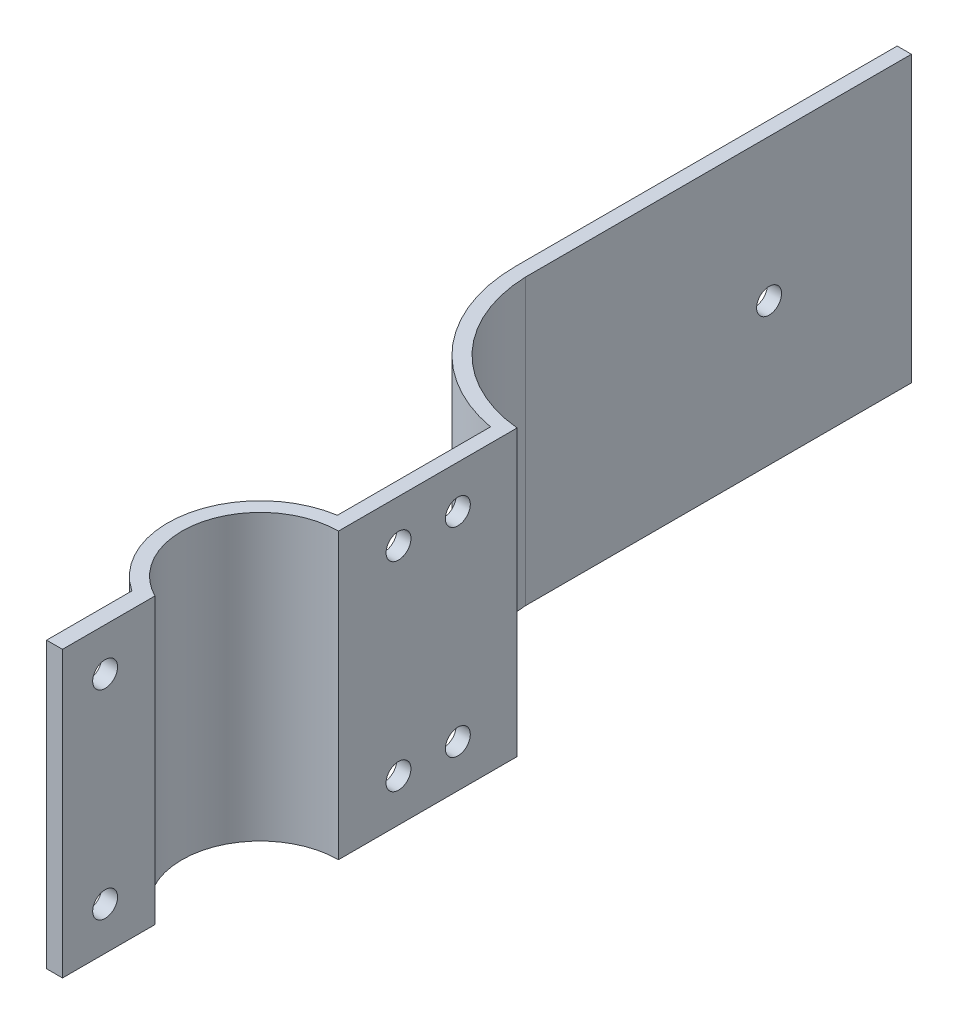
from build123d import *

# Parameters (mm, degrees)
BOSS_EXTRUDE1_DEPTH     = 40
CUT_EXTRUDE1_DEPTH      = 118.727312348
CUT_EXTRUDE1_DEPTH_BACK = 118.727312348
SKETCH3_R               = 1.75


with BuildPart() as part:
    # Sketch1 → Boss-Extrude1 (new body)
    with BuildSketch(Plane(origin=(0, 0, 0), x_dir=(1, 0, 0), z_dir=(0, 1, 0))):
        with BuildLine():
            Line((0, 11), (0, 36.098802305))
            ThreePointArc((0, 36.098802305), (-12.451450114, 42.224601119), (-17.776180484, 55.03909555))
            Line((-17.776180484, 55.03909555), (-17.776180484, 109.287361941))
            Line((-17.776180484, 109.287361941), (-19.776180484, 109.287361941))
            Line((-19.776180484, 109.287361941), (-19.776180484, 55.700978031))
            ThreePointArc((-19.776180484, 55.700978031), (-14.749868805, 41.814960106), (-2, 34.363373136))
            Line((-2, 34.363373136), (-2, 12.845232579))
            ThreePointArc((-2, 12.845232579), (-12.692786177, 2.809480212), (-7.234039362, -10.801327442))
            Line((-7.234039362, -10.801327442), (-7.234039362, -22.783960598))
            Line((-7.234039362, -22.783960598), (-5, -22.783960598))
            Line((-5, -22.783960598), (-5, -9.797958971))
            ThreePointArc((-5, -9.797958971), (-10.695268783, 2.571230378), (0, 11))
        make_face()
    extrude(amount=BOSS_EXTRUDE1_DEPTH)

    # Sketch3 → Cut-Extrude1 (cut, two sides: drawn at the far end of the back side and taken through both)
    with BuildSketch(Plane.ZY.offset(2).offset(-CUT_EXTRUDE1_DEPTH_BACK)):
        with Locations((-27.77399295, 34)):
            Circle(SKETCH3_R)
        with Locations((-19.434612764, 34)):
            Circle(SKETCH3_R)
        with Locations((16.79264402, 34)):
            Circle(SKETCH3_R)
        with Locations((-89.287361941, 20)):
            Circle(SKETCH3_R)
        with Locations((16.79264402, 6)):
            Circle(SKETCH3_R)
        with Locations(Location((-19.434612764, 6, 0), (0, 0, 180))):
            Circle(SKETCH3_R)
        with Locations(Location((-27.77399295, 6, 0), (0, 0, 180))):
            Circle(SKETCH3_R)
    extrude(amount=CUT_EXTRUDE1_DEPTH + CUT_EXTRUDE1_DEPTH_BACK, mode=Mode.SUBTRACT)


solid = part.part
